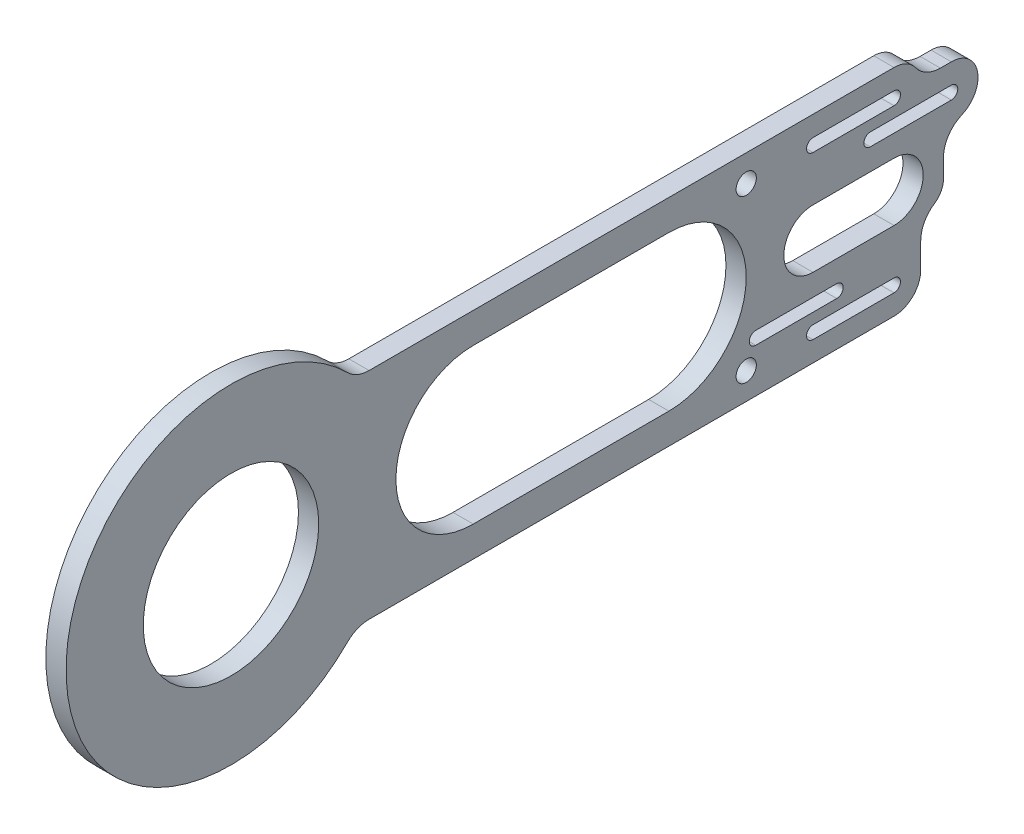
from build123d import *

# Parameters (mm, degrees)
SKETCH1_R           = 27.5
SKETCH1_R_2         = 3.175
BOSS_EXTRUDE1_DEPTH = 3.175


with BuildPart() as part:
    # Sketch1 → Boss-Extrude1 (new, symmetric)
    with BuildSketch(Plane(origin=(0, 0, 0), x_dir=(0, 0, -1), z_dir=(1, 0, 0))):
        with BuildLine():
            Line((43.290925291, 33.7693), (207.850950123, 33.7693))
            ThreePointArc((207.850950123, 33.7693), (211.66677379, 32.848803409), (214.643231519, 30.28979508))
            ThreePointArc((214.643231519, 30.28979508), (218.030702378, 27.377418378), (222.373445551, 26.329812242))
            Line((222.373445551, 26.329812242), (225.811462365, 26.329812242))
            ThreePointArc((225.811462365, 26.329812242), (234.009351835, 19.645680106), (229.112770692, 10.26983309))
            ThreePointArc((229.112770692, 10.26983309), (224.916562194, 6.758274432), (223.344950123, 1.517163342))
            Line((223.344950123, 1.517163342), (223.344950123, -4.239874171))
            ThreePointArc((223.344950123, -4.239874171), (222.587277992, -7.247924869), (220.495070123, -9.538143699))
            ThreePointArc((220.495070123, -9.538143699), (217.356758318, -12.973471943), (216.220250123, -17.48554799))
            Line((216.220250123, -17.48554799), (216.220250123, -25.4))
            ThreePointArc((216.220250123, -25.4), (213.768938906, -31.317988784), (207.850950123, -33.7693))
            Line((207.850950123, -33.7693), (43.290925291, -33.7693))
            ThreePointArc((43.290925291, -33.7693), (39.64603709, -34.49427642), (36.555995713, -36.558845406))
            ThreePointArc((36.555995713, -36.558845406), (-51.7, 0), (36.555995713, 36.558845406))
            ThreePointArc((36.555995713, 36.558845406), (39.64603709, 34.49427642), (43.290925291, 33.7693))
        make_face()
        Circle(SKETCH1_R, mode=Mode.SUBTRACT)
        with Locations((161.512193823, 25.4)):
            Circle(SKETCH1_R_2, mode=Mode.SUBTRACT)
        with Locations((161.512193823, -25.4)):
            Circle(SKETCH1_R_2, mode=Mode.SUBTRACT)
        with BuildLine():
            Line((75.9443, 24.2443), (137.267893823, 24.2443))
            ThreePointArc((137.267893823, 24.2443), (161.512193823, 0), (137.267893823, -24.2443))
            Line((137.267893823, -24.2443), (75.9443, -24.2443))
            ThreePointArc((75.9443, -24.2443), (51.7, 0), (75.9443, 24.2443))
        make_face(mode=Mode.SUBTRACT)
        with BuildLine():
            Line((182.450950123, 9.144), (207.850950123, 9.144))
            ThreePointArc((207.850950123, 9.144), (216.994950123, 0), (207.850950123, -9.144))
            Line((207.850950123, -9.144), (182.450950123, -9.144))
            ThreePointArc((182.450950123, -9.144), (173.306950123, 0), (182.450950123, 9.144))
        make_face(mode=Mode.SUBTRACT)
        with BuildLine():
            Line((164.490437881, -15.941212242), (189.890437881, -15.941212242))
            ThreePointArc((189.890437881, -15.941212242), (191.909737881, -17.960512242), (189.890437881, -19.979812242))
            Line((189.890437881, -19.979812242), (164.490437881, -19.979812242))
            ThreePointArc((164.490437881, -19.979812242), (162.471137881, -17.960512242), (164.490437881, -15.941212242))
        make_face(mode=Mode.SUBTRACT)
        with BuildLine():
            Line((200.411462365, 19.979812242), (225.811462365, 19.979812242))
            ThreePointArc((225.811462365, 19.979812242), (227.830762365, 17.960512242), (225.811462365, 15.941212242))
            Line((225.811462365, 15.941212242), (200.411462365, 15.941212242))
            ThreePointArc((200.411462365, 15.941212242), (198.392162365, 17.960512242), (200.411462365, 19.979812242))
        make_face(mode=Mode.SUBTRACT)
        with BuildLine():
            Line((182.450950123, 27.4193), (207.850950123, 27.4193))
            ThreePointArc((207.850950123, 27.4193), (209.870250123, 25.4), (207.850950123, 23.3807))
            Line((207.850950123, 23.3807), (182.450950123, 23.3807))
            ThreePointArc((182.450950123, 23.3807), (180.431650123, 25.4), (182.450950123, 27.4193))
        make_face(mode=Mode.SUBTRACT)
        with BuildLine():
            Line((182.450950123, -23.3807), (207.850950123, -23.3807))
            ThreePointArc((207.850950123, -23.3807), (209.870250123, -25.4), (207.850950123, -27.4193))
            Line((207.850950123, -27.4193), (182.450950123, -27.4193))
            ThreePointArc((182.450950123, -27.4193), (180.431650123, -25.4), (182.450950123, -23.3807))
        make_face(mode=Mode.SUBTRACT)
    extrude(amount=BOSS_EXTRUDE1_DEPTH, both=True)


solid = part.part
